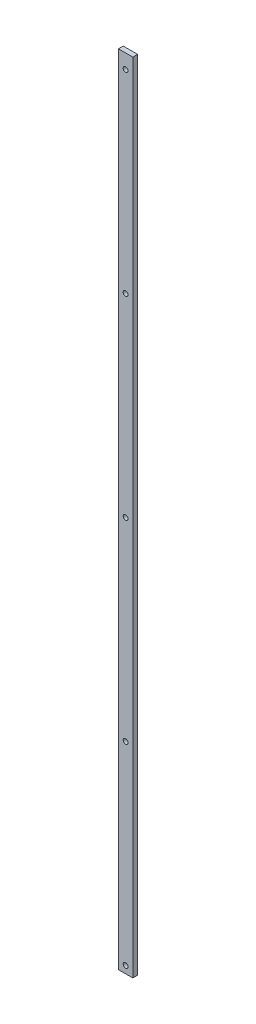
from build123d import *

# Parameters (mm, degrees)
SKETCH1_W           = 19.05
SKETCH1_H           = 1054.735
SKETCH1_R           = 3.175
BOSS_EXTRUDE1_DEPTH = 6.35


with BuildPart() as part:
    # Sketch1 → Boss-Extrude1 (new body)
    with BuildSketch(Plane.XY):
        with Locations((9.525, 527.3675)):
            Rectangle(SKETCH1_W, SKETCH1_H)
        with Locations((9.525, 9.525)):
            Circle(SKETCH1_R, mode=Mode.SUBTRACT)
        with Locations((9.525, 266.065)):
            Circle(SKETCH1_R, mode=Mode.SUBTRACT)
        with Locations((9.525, 522.605)):
            Circle(SKETCH1_R, mode=Mode.SUBTRACT)
        with Locations((9.525, 779.145)):
            Circle(SKETCH1_R, mode=Mode.SUBTRACT)
        with Locations((9.525, 1035.685)):
            Circle(SKETCH1_R, mode=Mode.SUBTRACT)
    extrude(amount=BOSS_EXTRUDE1_DEPTH)


solid = part.part
